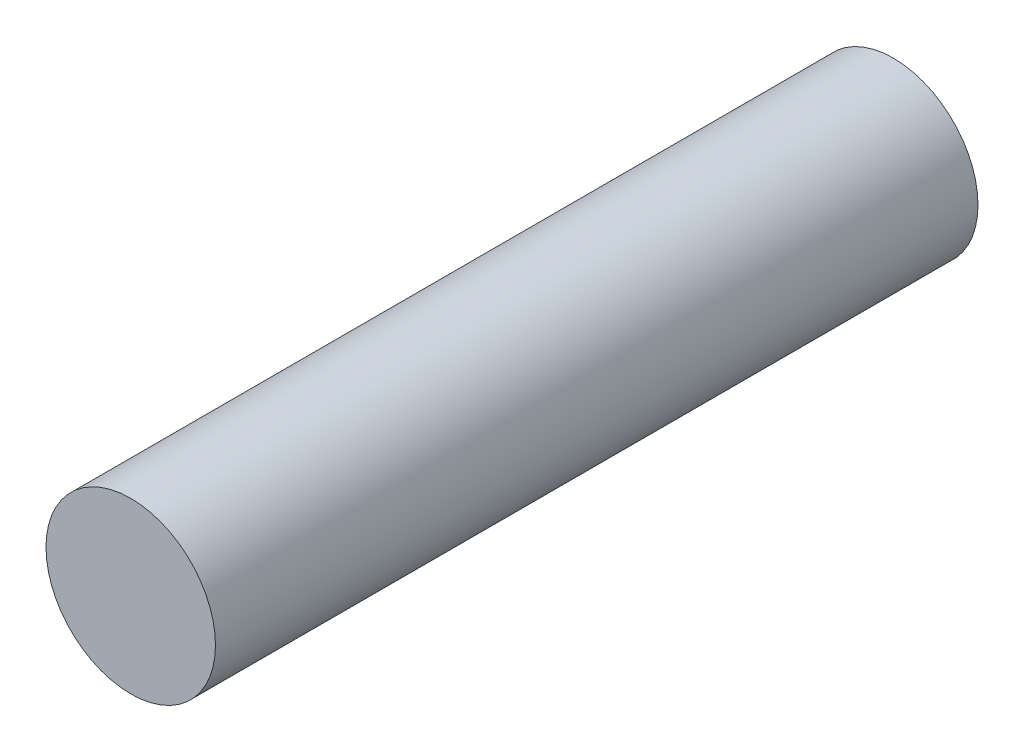
from build123d import *

# Parameters (mm, degrees)
SKETCH_1_R      = 3
EXTRUDE_1_DEPTH = 27


with BuildPart() as part:
    # 스케치1 → 보스-돌출1 (new body)
    with BuildSketch(Plane.XY):
        Circle(SKETCH_1_R)
    extrude(amount=EXTRUDE_1_DEPTH)


solid = part.part
